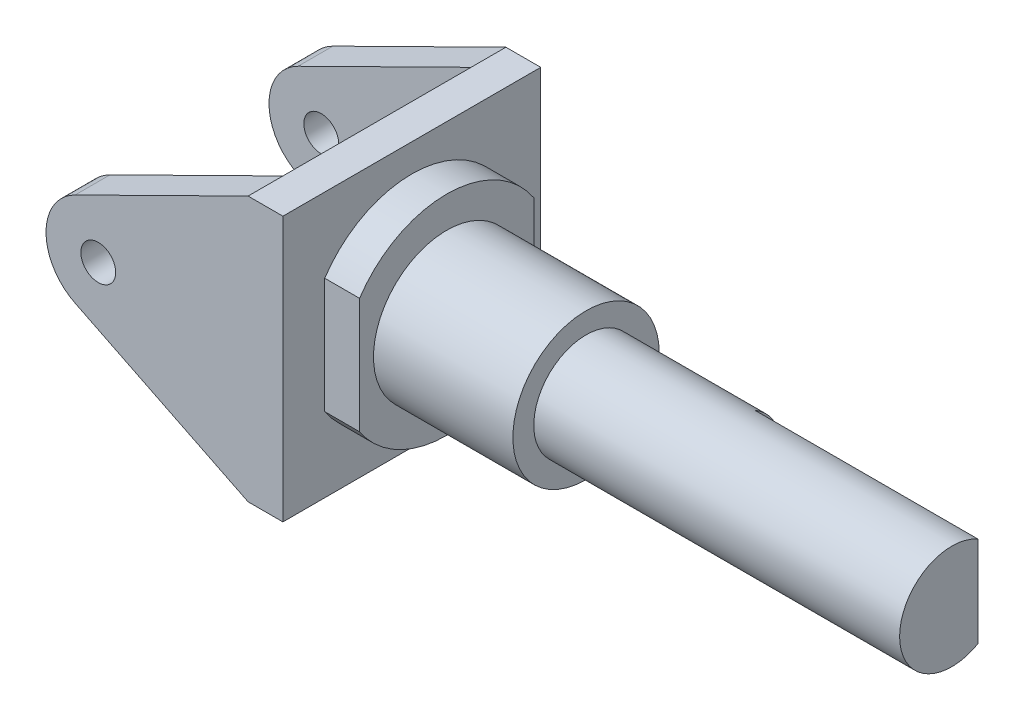
from build123d import *

# Parameters (mm, degrees)
SKETCH2_W           = 74
SKETCH2_H           = 76
BOSS_EXTRUDE1_DEPTH = 10
BOSS_EXTRUDE2_DEPTH = 10
HOLE1_D             = 10
CUT_EXTRUDE1_START  = -145
CUT_EXTRUDE1_DEPTH  = 10
CUT_EXTRUDE2_DEPTH  = 64


with BuildPart() as part:
    # Sketch1 → Revolve1 (revolve)
    with BuildSketch(Plane.XY, mode=Mode.PRIVATE) as revolve1_sk:
        Polygon((-77.5, 0), (-77.5, 30), (-67.5, 30), (-67.5, 21), (-27.5, 21), (-27.5, 15), (77.5, 15), (77.5, 0), align=None)
    revolve(revolve1_sk.sketch.rotate(Axis((77.5, 0, 0), (-1, 0, 0)), 90), axis=Axis((77.5, 0, 0), (-1, 0, 0)))

    # Sketch2 → Boss-Extrude1 (add)
    with BuildSketch(Plane.ZY.offset(77.5)):
        Rectangle(SKETCH2_W, SKETCH2_H)
    extrude(amount=BOSS_EXTRUDE1_DEPTH)

    # Sketch3 → Boss-Extrude2 (add)
    with BuildSketch(Plane(origin=(0, 0, -37), x_dir=(-1, 0, 0), z_dir=(0, 0, -1))):
        with BuildLine():
            Line((87.5, 38), (137.149569367, 13.445565337))
            ThreePointArc((137.149569367, 13.445565337), (145.5, 0), (137.149569367, -13.445565337))
            Line((137.149569367, -13.445565337), (87.5, -38))
            Line((87.5, -38), (77.5, -38))
            Line((77.5, -38), (77.5, 38))
            Line((77.5, 38), (87.5, 38))
        make_face()
    boss_extrude2 = extrude(amount=-BOSS_EXTRUDE2_DEPTH)

    # Mirror1: Boss-Extrude2 across plane
    add(boss_extrude2.mirror(Plane.XY))

    # Hole1 (through all)
    with Locations(Plane(origin=(0, 0, -37), x_dir=(-1, 0, 0), z_dir=(0, 0, -1))):
        with Locations((130.5, 0)):
            Hole(HOLE1_D / 2)

    # Sketch8 → Cut-Extrude1 (cut)
    with BuildSketch(Plane(origin=(77.5, 0, 0), x_dir=(0, 0, -1), z_dir=(1, 0, 0)).offset(CUT_EXTRUDE1_START)):
        with BuildLine():
            Line((25, 16.583123952), (25, -16.583123952))
            ThreePointArc((25, -16.583123952), (30, 0), (25, 16.583123952))
        make_face()
        with BuildLine():
            Line((-25, 16.583123952), (-25, -16.583123952))
            ThreePointArc((-25, -16.583123952), (-30, 0), (-25, 16.583123952))
        make_face()
    extrude(amount=-CUT_EXTRUDE1_DEPTH, mode=Mode.SUBTRACT)

    # Sketch9 → Cut-Extrude2 (cut)
    with BuildSketch(Plane(origin=(77.5, 0, 0), x_dir=(0, 0, -1), z_dir=(1, 0, 0))):
        with BuildLine():
            Line((7.5, 12.990381057), (7.5, -12.990381057))
            ThreePointArc((7.5, -12.990381057), (15, 0), (7.5, 12.990381057))
        make_face()
    extrude(amount=-CUT_EXTRUDE2_DEPTH, mode=Mode.SUBTRACT)


solid = part.part
